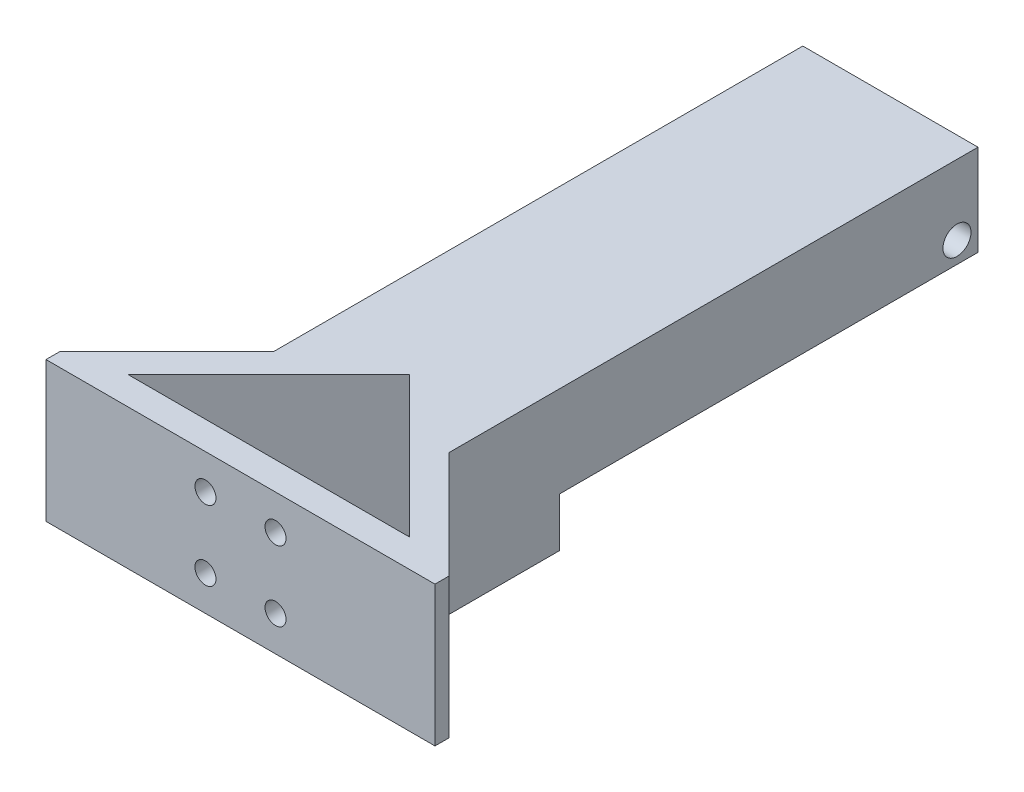
from build123d import *

# Parameters (mm, degrees)
EXTRUDE_1_DEPTH     = 20
SKETCH_2_R          = 1.5
CUT_EXTRUDE_1_DEPTH = 5
SKETCH_4_W          = 24.99770673
SKETCH_4_H          = 59.73
CUT_EXTRUDE_3_DEPTH = 7
SKETCH_8_R          = 2
CUT_EXTRUDE_5_DEPTH = 104.049289722


with BuildPart() as part:
    # 스케치1 → 보스-돌출1 (new body)
    with BuildSketch(Plane(origin=(0, 0, 0), x_dir=(1, 0, 0), z_dir=(0, 1, 0))):
        Polygon((40.24770673, 92.73229327), (15.25229327, 92.73229327), (15.25229327, 17.25229327), (0, 2), (0, 0), (55.5, 0), (55.5, 2), (40.24770673, 17.25229327), align=None)
        Polygon((27.75, 24.093145751), (47.843145751, 4), (7.656854249, 4), align=None, mode=Mode.SUBTRACT)
    extrude(amount=EXTRUDE_1_DEPTH)

    # 스케치2 → 컷-돌출1 (cut)
    with BuildSketch(Plane.XY):
        with Locations((22.75, 15)):
            Circle(SKETCH_2_R)
        with Locations(Location((32.75, 15, 0), (0, 0, 180))):
            Circle(SKETCH_2_R)
        with Locations((32.75, 5)):
            Circle(SKETCH_2_R)
        with Locations(Location((22.75, 5, 0), (0, 0, 180))):
            Circle(SKETCH_2_R)
    extrude(amount=-CUT_EXTRUDE_1_DEPTH, mode=Mode.SUBTRACT)

    # 스케치4 → 컷-돌출3 (cut)
    with BuildSketch(Plane.XZ):
        with Locations((27.748853365, -62.86729327)):
            Rectangle(SKETCH_4_W, SKETCH_4_H)
    extrude(amount=-CUT_EXTRUDE_3_DEPTH, mode=Mode.SUBTRACT)

    # 스케치8 → 컷-돌출5 (cut, through all)
    with BuildSketch(Plane.ZY.offset(-15.25229327)):
        with Locations((-89.73229327, 10)):
            Circle(SKETCH_8_R)
    extrude(amount=-CUT_EXTRUDE_5_DEPTH, mode=Mode.SUBTRACT)


solid = part.part
